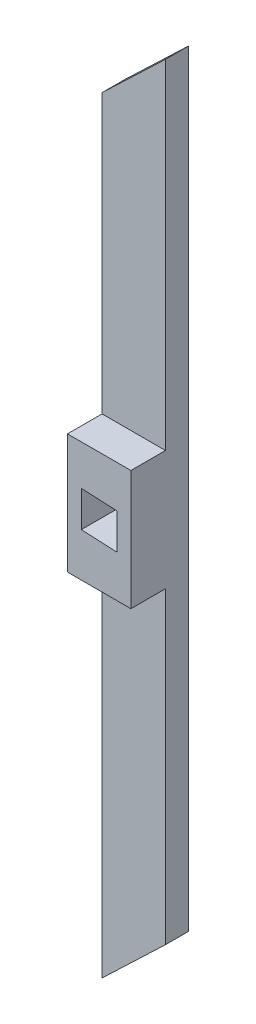
from build123d import *

# Parameters (mm, degrees)
BOSS_EXTRU_2_DEPTH       = 10
ENL_V_MAT_EXTRU_25_DEPTH = 7
ESQUISSE5_W              = 37.59862274
ESQUISSE5_H              = 68.527189437
ENL_V_MAT_EXTRU_26_DEPTH = 6


with BuildPart() as part:
    # Esquisse2 → Boss.-Extru.2 (new body)
    with BuildSketch(Plane.XY):
        Polygon((0, 64.5), (0, -68.5), (11, -58), (11, 75), align=None)
    extrude(amount=BOSS_EXTRU_2_DEPTH)

    # Esquisse4 → Enlèv. mat.-Extru.25 (cut)
    with BuildSketch(Plane.XY.offset(10)):
        Polygon((2.407262121, 3.056563683), (2.407262121, 9.256563683), (8.6, 8.956567739), (8.6, 2.756567739), align=None)
    extrude(amount=-ENL_V_MAT_EXTRU_25_DEPTH, mode=Mode.SUBTRACT)

    # Esquisse5 → Enlèv. mat.-Extru.26 (cut)
    with BuildSketch(Plane.XY.offset(10)):
        with Locations((3.383685942, 50.502193636)):
            Rectangle(ESQUISSE5_W, ESQUISSE5_H)
        with Locations((3.383685942, -38.789058157)):
            Rectangle(ESQUISSE5_W, ESQUISSE5_H)
    extrude(amount=-ENL_V_MAT_EXTRU_26_DEPTH, mode=Mode.SUBTRACT)


solid = part.part
